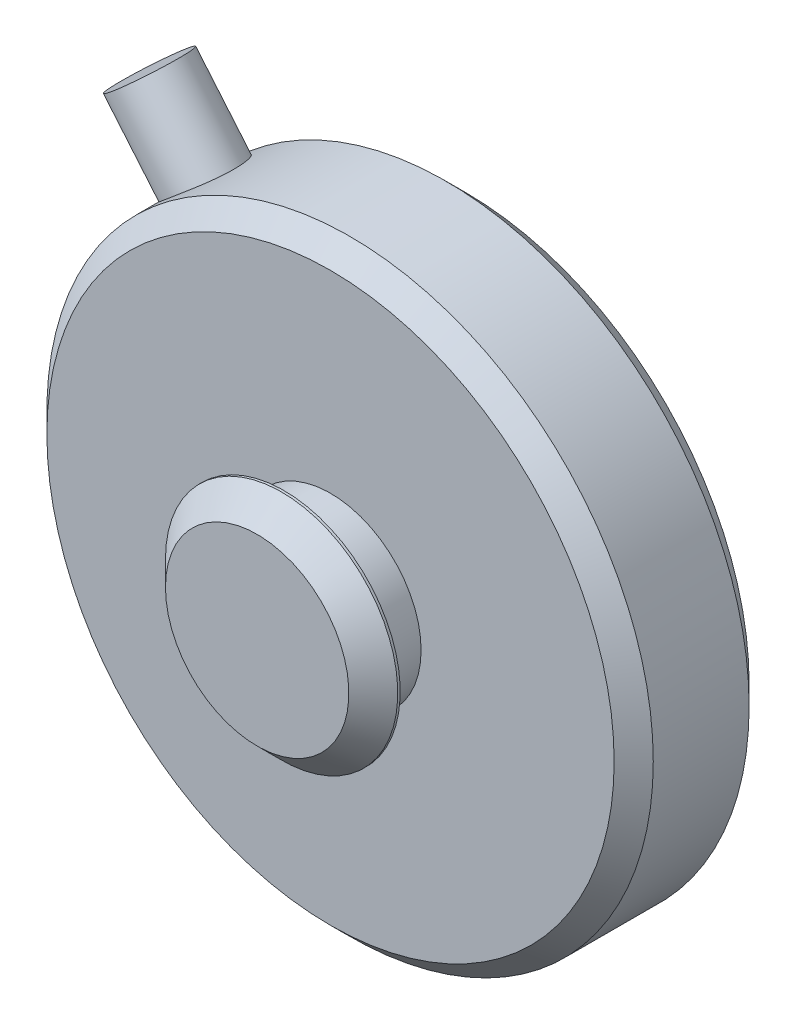
from build123d import *
from build123d.topology import SkipClean

# Parameters (mm, degrees)
SKETCH1_R                  = 157.48000000000002
EXTRUDE1_DEPTH             = 70.10399999999998
SKETCH2_R                  = 47.0535
EXTRUDE2_DEPTH             = 24.130000000000003
SKETCH3_R                  = 15.011400000000002
EXTRUDE3_DEPTH             = 13.462
SKETCH4_R                  = 24.511
EXTRUDE4_DEPTH             = 6.35
SKETCH5_R                  = 15.875
EXTRUDE5_DEPTH             = 6.8580000000000005
SKETCH6_R                  = 3.174999999999999
CUT_EXTRUDE1_DEPTH         = 11.43
CIRPATTERN1_COUNT          = 5
SKETCH7_R                  = 60.325
EXTRUDE6_DEPTH             = 13.970000000000011
CHAMFER1_SIZE              = 10.16
CHAMFER2_SIZE              = 12.7
EXTRUDE7_REACH             = 396.95
EXTRUDE7_END_RADIUS        = 157.48000000000002
SKETCH8_R                  = 19.05
EXTRUDE7_DIRECTION_2_DEPTH = 44.449999999999996


with BuildPart() as part:
    # Sketch1 → Extrude1 (new body)
    with BuildSketch(Plane.XY):
        Circle(SKETCH1_R)
    extrude(amount=EXTRUDE1_DEPTH)

    # Sketch2 → Extrude2 (add)
    with BuildSketch(Plane.XY.offset(70.10399999999998)):
        Circle(SKETCH2_R)
    extrude(amount=EXTRUDE2_DEPTH)

    # Sketch3 → Extrude3 (add)
    with BuildSketch(Plane(origin=(0, 0, 0), x_dir=(-1, 0, 0), z_dir=(0, 0, -1))):
        Circle(SKETCH3_R)
    extrude(amount=EXTRUDE3_DEPTH)

    # Sketch4 → Extrude4 (add)
    with BuildSketch(Plane(origin=(0, 0, -13.462), x_dir=(-1, 0, 0), z_dir=(0, 0, -1))):
        Circle(SKETCH4_R)
    extrude(amount=EXTRUDE4_DEPTH)

    # Sketch5 → Extrude5 (add)
    with BuildSketch(Plane(origin=(0, 0, -19.812), x_dir=(-1, 0, 0), z_dir=(0, 0, -1))):
        Circle(SKETCH5_R)
    extrude(amount=EXTRUDE5_DEPTH)

    # Sketch6 → Cut-Extrude1 (cut)
    with BuildSketch(Plane(origin=(0, 0, 0), x_dir=(-1, 0, 0), z_dir=(0, 0, -1))):
        with Locations((0, -38.1)):
            Circle(SKETCH6_R)
    cut_extrude1 = extrude(amount=-CUT_EXTRUDE1_DEPTH, mode=Mode.SUBTRACT)

    # CirPattern1: Cut-Extrude1 ×5 about axis
    cirpattern1_axis = Axis((0, 0, 70.10399999999998), (0, 0, -1))
    for i in range(1, CIRPATTERN1_COUNT):
        add(cut_extrude1.rotate(cirpattern1_axis, i * 360 / CIRPATTERN1_COUNT), mode=Mode.SUBTRACT)

    # Sketch7 → Extrude6 (add)
    with BuildSketch(Plane.XY.offset(94.23399999999998)):
        Circle(SKETCH7_R)
    extrude(amount=EXTRUDE6_DEPTH)

    # Chamfer1
    chamfer1_edges = [part.edges().sort_by_distance(p)[0] for p in [
        (-157.48000000000002, 1.929e-14, 0),
        (-157.48000000000002, 1.929e-14, 70.10399999999998),
    ]]
    chamfer(chamfer1_edges, length=CHAMFER1_SIZE)

    # Chamfer2
    chamfer2_edges = [part.edges().sort_by_distance(p)[0] for p in [
        (-60.325, 7.39e-15, 108.204),
    ]]
    chamfer(chamfer2_edges, length=CHAMFER2_SIZE)

    # Extrude7: up to this cylinder (the profile starts outside it)
    with SkipClean():  # the faces are left unmerged after this step: merging them gives an invalid solid
        extrude7_end = Plane(origin=(0, 0, 34.29), z_dir=(0, 0, -1)) * Cylinder(EXTRUDE7_END_RADIUS, 1109.8600000000001, mode=Mode.PRIVATE)
        # Sketch8 → Extrude7 (add, up to the surface)
        with BuildSketch(Plane(origin=(-101.22619277343593, 120.63667890237693, 0), x_dir=(0.7660444431189796, 0.6427876096865376, 0), z_dir=(0.6427876096865376, -0.7660444431189797, 0)), mode=Mode.PRIVATE) as extrude7_sk1:
            with Locations((-1.388e-14, 34.290000000000056)):
                Circle(SKETCH8_R)
        extrude7_tool1 = extrude(extrude7_sk1.sketch, amount=EXTRUDE7_REACH, mode=Mode.PRIVATE) - extrude7_end
        add(extrude7_tool1.solids().sort_by_distance((-101.226193, 120.636679, 34.29))[0])
        add(extrude7_tool1.solids().sort_by_distance((-101.226193, 120.636679, 34.29))[1])

    # Sketch8 → Extrude7 direction 2 (add)
    with BuildSketch(Plane(origin=(-101.22619277343593, 120.63667890237693, 0), x_dir=(0.7660444431189796, 0.6427876096865376, 0), z_dir=(0.6427876096865376, -0.7660444431189797, 0))):
        with Locations((-1.388e-14, 34.290000000000056)):
            Circle(SKETCH8_R)
    extrude(amount=-EXTRUDE7_DIRECTION_2_DEPTH)


solid = part.part
